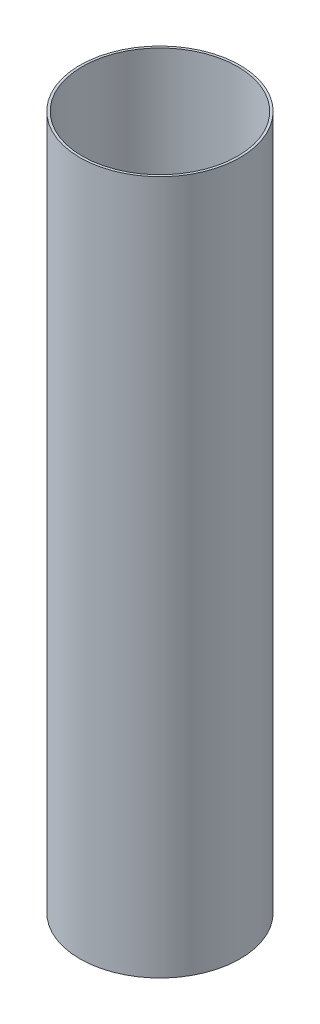
from build123d import *

# Parameters (mm, degrees)
BOSS_EXTRUDE1_DEPTH      = 350
BOSS_EXTRUDE1_DEPTH_BACK = 350
SKETCH1_R                = 80.75
SKETCH1_R_2              = 78.35


with BuildPart() as part:
    # Sketch1 → Boss-Extrude1 (new, two sides: drawn at the far end of the back side and taken through both)
    with BuildSketch(Plane(origin=(0, 0, 0), x_dir=(1, 0, 0), z_dir=(0, 1, 0)).offset(-BOSS_EXTRUDE1_DEPTH_BACK)):
        Circle(SKETCH1_R)
        Circle(SKETCH1_R_2, mode=Mode.SUBTRACT)
    extrude(amount=BOSS_EXTRUDE1_DEPTH + BOSS_EXTRUDE1_DEPTH_BACK)


solid = part.part
